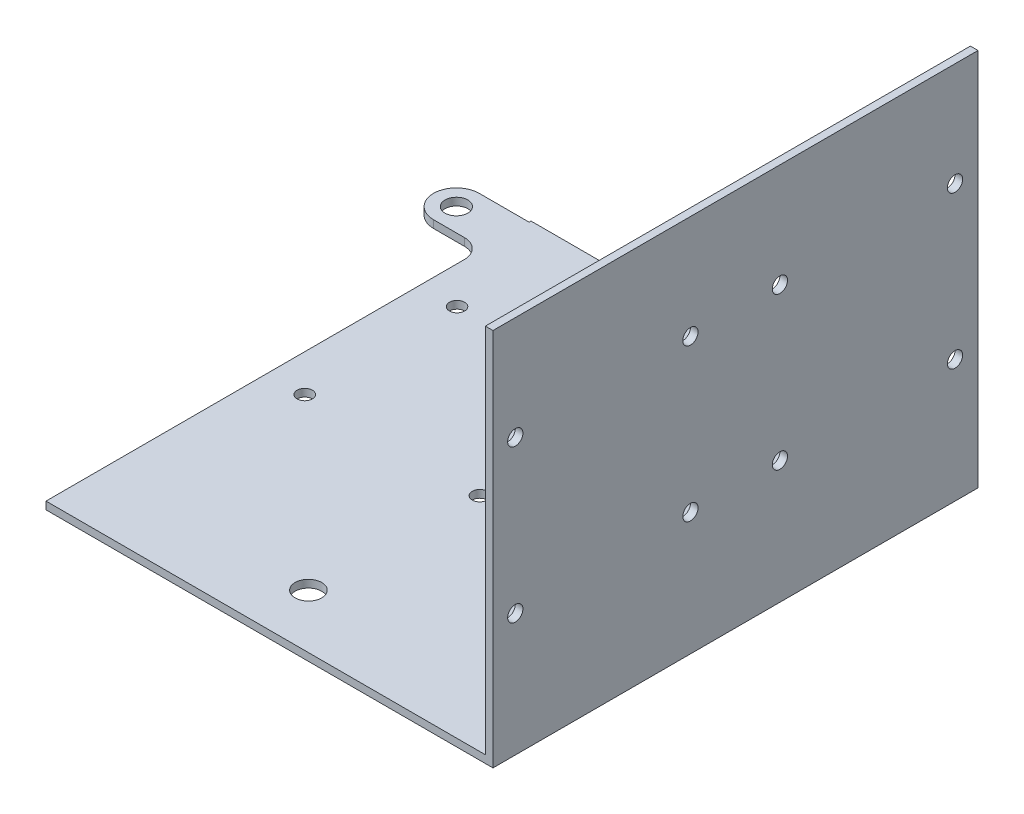
from build123d import *

# Parameters (mm, degrees)
SKETCH_1_W          = 127.39196645
SKETCH_1_H          = 99.499845157
SKETCH_1_R          = 2
EXTRUDE_1_DEPTH     = 2
SKETCH_2_W          = 127.39196645
SKETCH_2_H          = 2
EXTRUDE_2_DEPTH     = 115.4
SKETCH_4_R          = 2
CUT_EXTRUDE_1_DEPTH = 144.079097981
SKETCH_6_R          = 3.5
CUT_EXTRUDE_2_DEPTH = 166.366738145
SKETCH_7_R          = 3
EXTRUDE_3_DEPTH     = 2
FILLET_1_R          = 5
SKETCH_8_W          = 161.877108061
SKETCH_8_H          = 133.071465469
CUT_EXTRUDE_3_DEPTH = 179.583476668


with BuildPart() as part:
    # Эскиз1 → Бобышка-Вытянуть1 (new body)
    with BuildSketch(Plane(origin=(0, 0, 0), x_dir=(0, 0, -1), z_dir=(1, 0, 0))):
        with Locations((0, 20.12589484)):
            Rectangle(SKETCH_1_W, SKETCH_1_H)
        with Locations((11.663084527, 42.625972261)):
            Circle(SKETCH_1_R, mode=Mode.SUBTRACT)
        with Locations((57.663084527, 42.625972261)):
            Circle(SKETCH_1_R, mode=Mode.SUBTRACT)
        with Locations((57.663084527, 2.625972261)):
            Circle(SKETCH_1_R, mode=Mode.SUBTRACT)
        with Locations((11.663084527, 2.625972261)):
            Circle(SKETCH_1_R, mode=Mode.SUBTRACT)
        with Locations(Location((-11.836915473, 2.625972261, 0), (0, 0, 180))):
            Circle(SKETCH_1_R, mode=Mode.SUBTRACT)
        with Locations(Location((-57.836915473, 2.625972261, 0), (0, 0, 180))):
            Circle(SKETCH_1_R, mode=Mode.SUBTRACT)
        with Locations(Location((-57.836915473, 42.625972261, 0), (0, 0, 180))):
            Circle(SKETCH_1_R, mode=Mode.SUBTRACT)
        with Locations(Location((-11.836915473, 42.625972261, 0), (0, 0, 180))):
            Circle(SKETCH_1_R, mode=Mode.SUBTRACT)
    extrude(amount=EXTRUDE_1_DEPTH)

    # Эскиз2 → Бобышка-Вытянуть2 (add)
    with BuildSketch(Plane(origin=(2, 0, 0), x_dir=(0, 0, -1), z_dir=(1, 0, 0))):
        with Locations((0, -28.624027739)):
            Rectangle(SKETCH_2_W, SKETCH_2_H)
    extrude(amount=EXTRUDE_2_DEPTH)

    # Эскиз4 → Вырез-Вытянуть1 (cut, through all)
    with BuildSketch(Plane(origin=(0, 21.675972261, 0), x_dir=(1, 0, 0), z_dir=(0, 1, 0))):
        with Locations(Location((61.65, 34.512555998, 0), (0, 0, 270))):
            Circle(SKETCH_4_R)
        with Locations(Location((61.65, -5.487444002, 0), (0, 0, 270))):
            Circle(SKETCH_4_R)
        with Locations(Location((107.65, -5.487444002, 0), (0, 0, 270))):
            Circle(SKETCH_4_R)
        with Locations(Location((107.65, 34.512555998, 0), (0, 0, 270))):
            Circle(SKETCH_4_R)
    extrude(amount=-CUT_EXTRUDE_1_DEPTH, mode=Mode.SUBTRACT)

    # Эскиз6 → Вырез-Вытянуть2 (cut, through all)
    with BuildSketch(Plane(origin=(0, -27.624027739, 0), x_dir=(1, 0, 0), z_dir=(0, 1, 0))):
        with Locations(Location((62.669967975, -49.504016775, 0), (0, 0, 270))):
            Circle(SKETCH_6_R)
        with Locations(Location((40.99052879, -0.086168012, 0), (0, 0, 270))):
            Circle(SKETCH_6_R)
    extrude(amount=-CUT_EXTRUDE_2_DEPTH, mode=Mode.SUBTRACT)

    # Эскиз7 → Бобышка-Вытянуть3 (add)
    with BuildSketch(Plane(origin=(0, -27.624027739, 0), x_dir=(1, 0, 0), z_dir=(0, 1, 0))):
        with BuildLine():
            Line((130.5, 51.195983225), (117.4, 51.195983225))
            Line((117.4, 51.195983225), (117.4, 63.195983225))
            Line((117.4, 63.195983225), (130.5, 63.195983225))
            ThreePointArc((130.5, 63.195983225), (136.5, 57.195983225), (130.5, 51.195983225))
        make_face()
        with Locations(Location((130.5, 57.195983225, 0), (0, 0, 270))):
            Circle(SKETCH_7_R, mode=Mode.SUBTRACT)
    extrude(amount=-EXTRUDE_3_DEPTH)

    # Скругление1
    fillet_1_edges = [part.edges().sort_by_distance(p)[0] for p in [
        (117.4, -28.624027739, -51.195983225),
    ]]
    fillet(fillet_1_edges, radius=FILLET_1_R)


with BuildPart() as body_2:
    # Зеркальное отражение1: mirrored copy
    add(part.part.mirror(Plane.ZY.offset(15)))


with BuildPart() as part_1:
    add(part.part)

    # Эскиз8 → Вырез-Вытянуть3 (cut, through all)
    with BuildSketch(Plane.ZY.offset(15)):
        with Locations((1.413773869, 20.567699173)):
            Rectangle(SKETCH_8_W, SKETCH_8_H)
    extrude(amount=-CUT_EXTRUDE_3_DEPTH, mode=Mode.SUBTRACT)


solid = body_2.part
